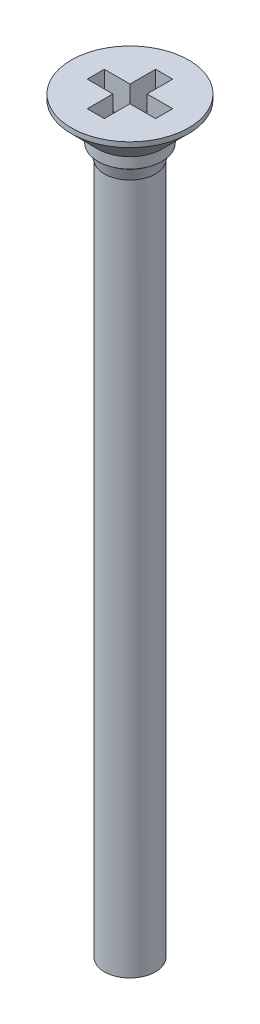
from build123d import *

# Parameters (mm, degrees)
KREUZSCHLITZ1_H_DEPTH      = 0.4
KREUZSCHLITZ1_H_DEPTH_BACK = 0.4
KREUZSCHLITZ2_H_DEPTH      = 0.4
KREUZSCHLITZ2_H_DEPTH_BACK = 0.4
BOSS_EXTRUDE1_START        = 27
SKETCH1_R                  = 1.1935
BOSS_EXTRUDE1_DEPTH        = 27


with BuildPart() as part:
    # Skizze1 → Basis-Rotation (revolve)
    with BuildSketch(Plane.XY, mode=Mode.PRIVATE) as basis_rotation_sk:
        Polygon((0, 0), (2.75, 0), (2.75, -0.2375), (1.5, -1.4875), (1.5, -1.9875), (1.3375, -1.9875), (1.3375, -2.112584684), (1.1935, -2.65), (1.1935, -8), (0, -8), align=None)
    revolve(basis_rotation_sk.sketch.rotate(Axis((0, 0, 0), (0, -1, 0)), 180), axis=Axis((0, 0, 0), (0, -1, 0)))

    # Skizze2 → Kreuzschlitz1 H (cut, two sides: drawn at the far end of the back side and taken through both)
    with BuildSketch(Plane.XY.offset(-KREUZSCHLITZ1_H_DEPTH_BACK)):
        Polygon((-0.55, -2.1), (0.55, -2.1), (1.6, -1.05), (1.6, 0), (-1.6, 0), (-1.6, -1.05), align=None)
    extrude(amount=KREUZSCHLITZ1_H_DEPTH + KREUZSCHLITZ1_H_DEPTH_BACK, mode=Mode.SUBTRACT)

    # Skizze3 → Kreuzschlitz2 H (cut, two sides: drawn at the far end of the back side and taken through both)
    with BuildSketch(Plane(origin=(0, 0, 0), x_dir=(0, 0, -1), z_dir=(1, 0, 0)).offset(-KREUZSCHLITZ2_H_DEPTH_BACK)):
        Polygon((-0.55, -2.1), (0.55, -2.1), (1.6, -1.05), (1.6, 0), (-1.6, 0), (-1.6, -1.05), align=None)
    extrude(amount=KREUZSCHLITZ2_H_DEPTH + KREUZSCHLITZ2_H_DEPTH_BACK, mode=Mode.SUBTRACT)

    # Sketch1 → Boss-Extrude1 (add)
    with BuildSketch(Plane.XZ.offset(8).offset(BOSS_EXTRUDE1_START)):
        with Locations(Location((0, 0, 0), (0, 0, 180))):
            Circle(SKETCH1_R)
    extrude(amount=-BOSS_EXTRUDE1_DEPTH)


solid = part.part
